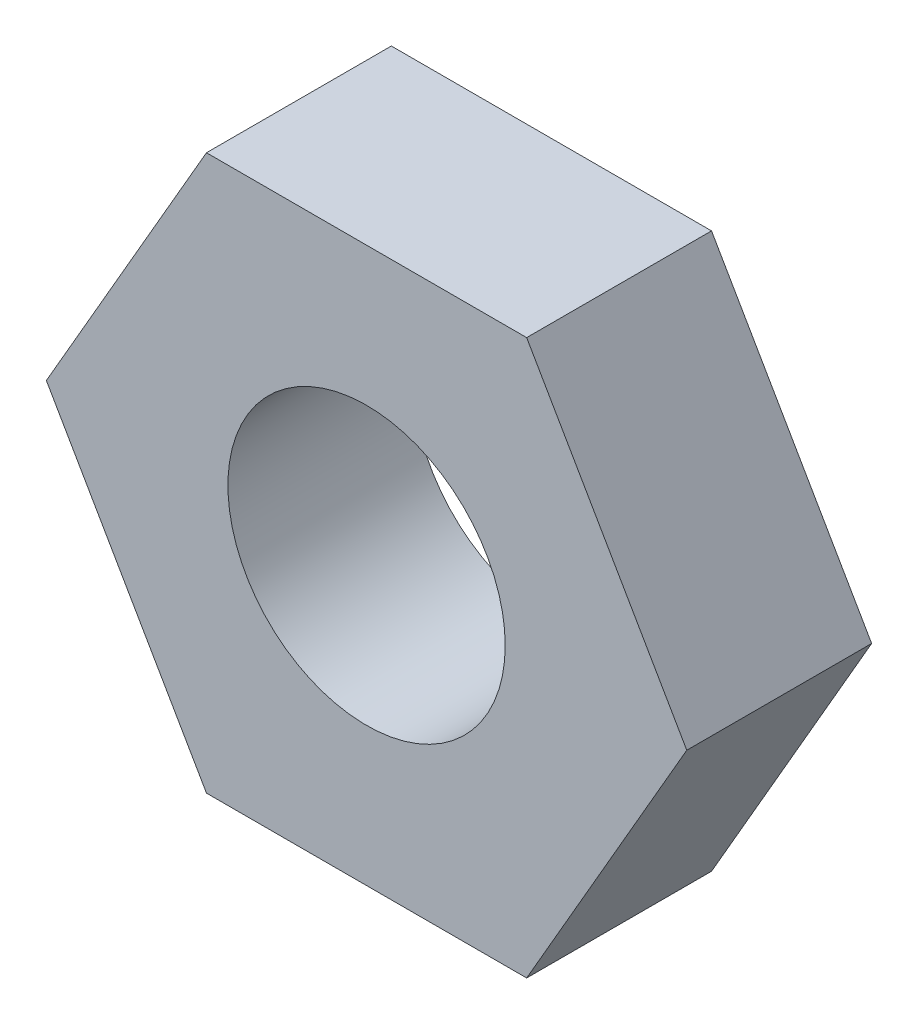
from build123d import *

# Parameters (mm, degrees)
SKETCH_1_R      = 1.5
EXTRUDE_1_DEPTH = 2


with BuildPart() as part:
    # 草图1 → 凸台-拉伸1 (new body)
    with BuildSketch(Plane.XY):
        Polygon((3.464101615, 0), (1.732050808, 3), (-1.732050808, 3), (-3.464101615, 0), (-1.732050808, -3), (1.732050808, -3), align=None)
        Circle(SKETCH_1_R, mode=Mode.SUBTRACT)
    extrude(amount=EXTRUDE_1_DEPTH)


solid = part.part
